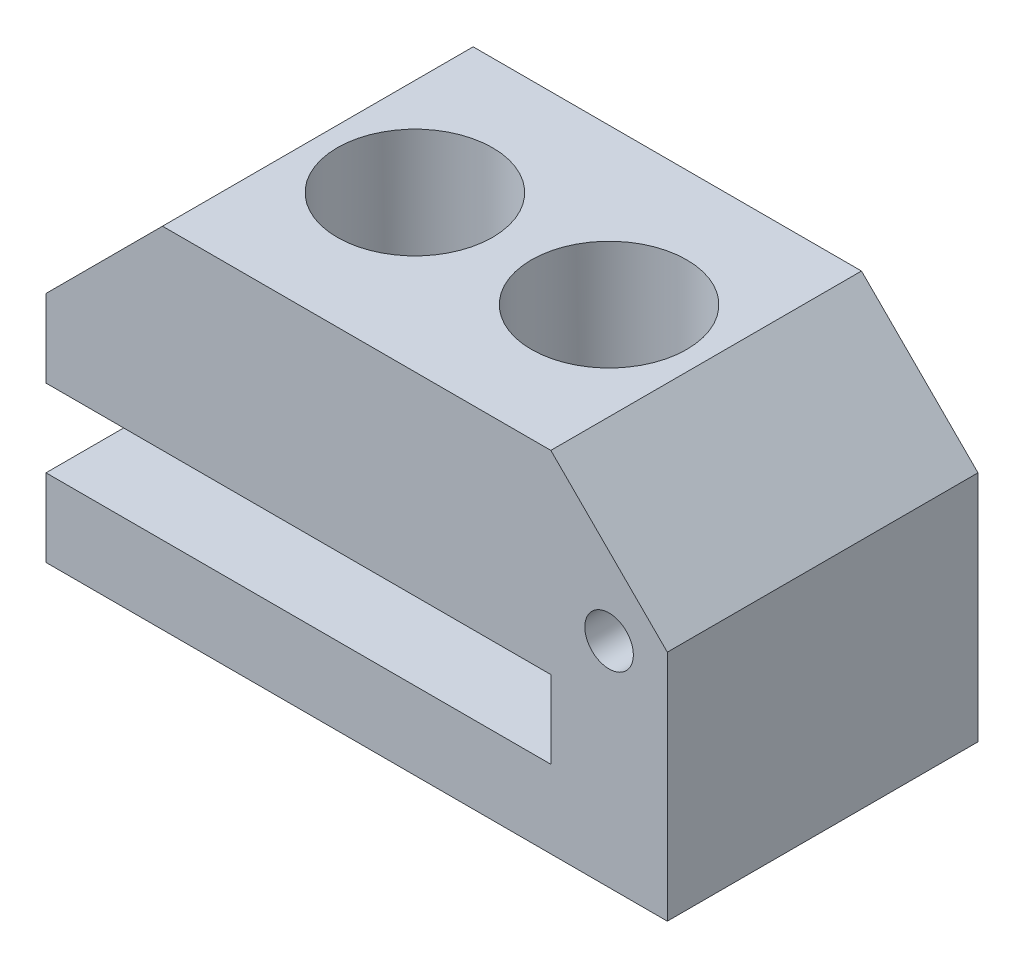
from build123d import *

# Parameters (mm, degrees)
BOSS_EXTRUDE1_DEPTH = 16
SKETCH2_R           = 4
CUT_EXTRUDE1_DEPTH  = 40
SKETCH3_W           = 26
SKETCH3_H           = 4
CUT_EXTRUDE2_DEPTH  = 40
SKETCH4_R           = 1.25
CUT_EXTRUDE3_DEPTH  = 40


with BuildPart() as part:
    # Sketch1 → Boss-Extrude1 (new body)
    with BuildSketch(Plane.XY):
        Polygon((0, 0), (32, 0), (32, 12), (26, 18), (6, 18), (0, 12), align=None)
    extrude(amount=BOSS_EXTRUDE1_DEPTH)

    # Sketch2 → Cut-Extrude1 (cut, symmetric)
    with BuildSketch(Plane(origin=(0, 0, 0), x_dir=(1, 0, 0), z_dir=(0, 1, 0))):
        with Locations(Location((11, -8, 0), (0, 0, 270))):
            Circle(SKETCH2_R)
        with Locations(Location((21, -8, 0), (0, 0, 270))):
            Circle(SKETCH2_R)
    extrude(amount=CUT_EXTRUDE1_DEPTH, both=True, mode=Mode.SUBTRACT)

    # Sketch3 → Cut-Extrude2 (cut, symmetric)
    with BuildSketch(Plane.XY):
        with Locations((13, 6)):
            Rectangle(SKETCH3_W, SKETCH3_H)
    extrude(amount=CUT_EXTRUDE2_DEPTH, both=True, mode=Mode.SUBTRACT)

    # Sketch4 → Cut-Extrude3 (cut, symmetric)
    with BuildSketch(Plane.XY):
        with Locations((29, 11)):
            Circle(SKETCH4_R)
    extrude(amount=CUT_EXTRUDE3_DEPTH, both=True, mode=Mode.SUBTRACT)


solid = part.part
